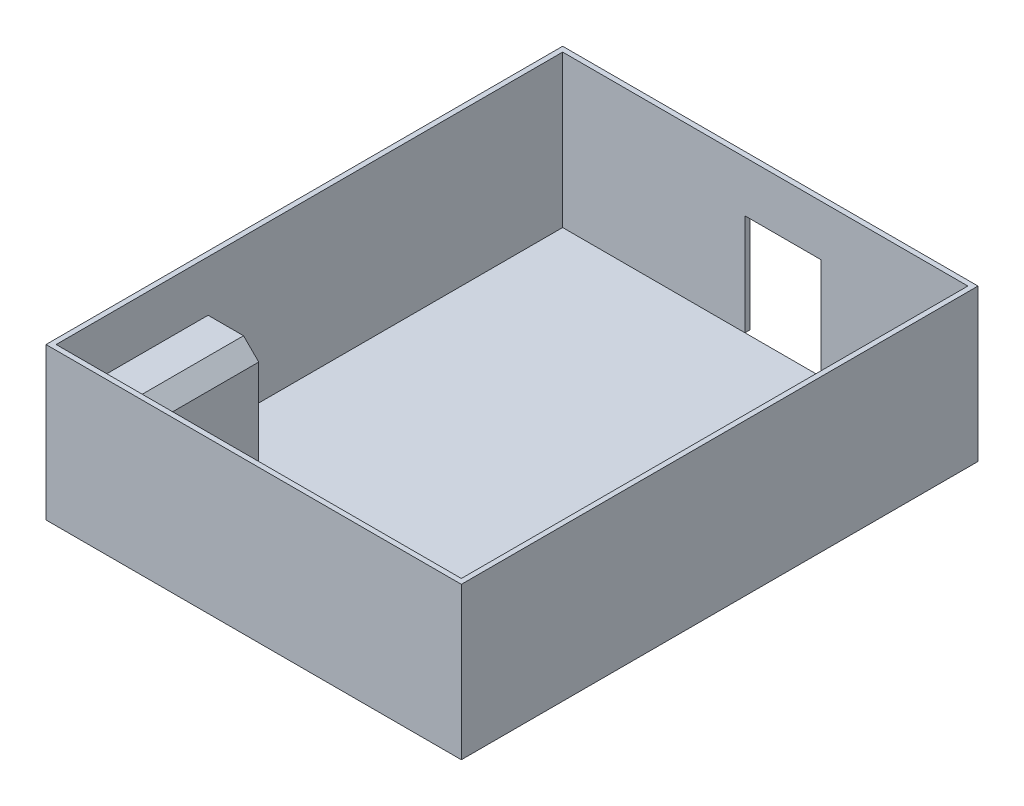
from build123d import *

# Parameters (mm, degrees)
SKETCH1_W           = 8000
SKETCH1_H           = 10000
BOSS_EXTRUDE1_DEPTH = 10
SKETCH3_W           = 8200
SKETCH3_H           = 10200
SKETCH3_W_2         = 8000
SKETCH3_H_2         = 10000
BOSS_EXTRUDE2_DEPTH = 3000
SKETCH4_W           = 1500
SKETCH4_H           = 2000
CUT_EXTRUDE1_DEPTH  = 100
SKETCH5_W           = 1000
SKETCH5_H           = 3000
BOSS_EXTRUDE4_DEPTH = 2000
CHAMFER1_SIZE       = 300


with BuildPart() as part:
    # Sketch1 → Boss-Extrude1 (new body)
    with BuildSketch(Plane(origin=(0, 0, 0), x_dir=(1, 0, 0), z_dir=(0, 1, 0))):
        with Locations((-4000, 5000)):
            Rectangle(SKETCH1_W, SKETCH1_H)
    extrude(amount=BOSS_EXTRUDE1_DEPTH)


with BuildPart() as body_2:
    # Sketch3 → Boss-Extrude2 (new body)
    with BuildSketch(Plane(origin=(0, 10, 0), x_dir=(1, 0, 0), z_dir=(0, 1, 0))):
        with Locations((-4000, 5000)):
            Rectangle(SKETCH3_W, SKETCH3_H)
        with Locations((-4000, 5000)):
            Rectangle(SKETCH3_W_2, SKETCH3_H_2, mode=Mode.SUBTRACT)
    extrude(amount=BOSS_EXTRUDE2_DEPTH)

    # Sketch4 → Cut-Extrude1 (cut)
    with BuildSketch(Plane(origin=(0, 0, -10100), x_dir=(-1, 0, 0), z_dir=(0, 0, -1))):
        with Locations((3650, 1010)):
            Rectangle(SKETCH4_W, SKETCH4_H)
    extrude(amount=-CUT_EXTRUDE1_DEPTH, mode=Mode.SUBTRACT)


with BuildPart() as body_3:
    # Sketch5 → Boss-Extrude4 (new body)
    with BuildSketch(Plane(origin=(0, 10, 0), x_dir=(1, 0, 0), z_dir=(0, 1, 0))):
        with Locations((-7500, 1500)):
            Rectangle(SKETCH5_W, SKETCH5_H)
    extrude(amount=BOSS_EXTRUDE4_DEPTH)

    # Chamfer1
    chamfer1_edges = [body_3.edges().sort_by_distance(p)[0] for p in [
        (-7000, 2010, -1500),
    ]]
    chamfer(chamfer1_edges, length=CHAMFER1_SIZE)


solid = Compound([part.part, body_2.part, body_3.part])
